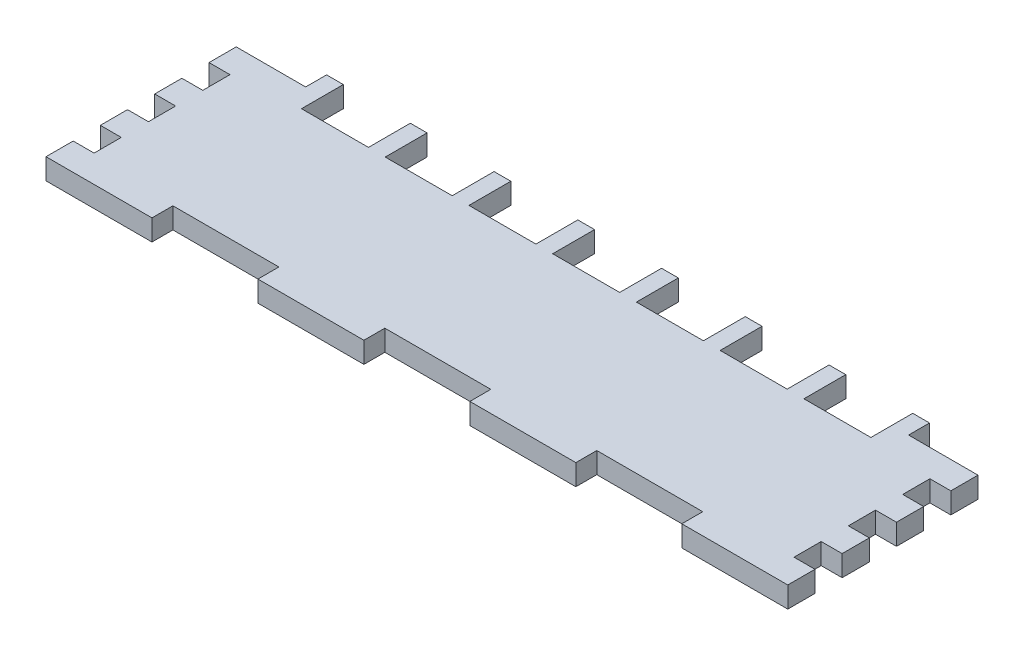
from build123d import *

# Parameters (mm, degrees)
SKETCH1_W           = 25.792857143
SKETCH1_H           = 6.35
SKETCH1_W_2         = 32.142857143
SKETCH1_W_3         = 6.35
SKETCH1_H_2         = 1.892857143
SKETCH1_H_3         = 8.242857143
BOSS_EXTRUDE1_DEPTH = 6.35
SKETCH2_W           = 225
SKETCH2_H           = 8.242857143
BOSS_EXTRUDE2_DEPTH = 6.35
SKETCH3_W           = 5.08
SKETCH3_H           = 6.35
BOSS_EXTRUDE3_DEPTH = 6.35
SKETCH4_W           = 20.32
SKETCH4_H           = 6.35
CUT_EXTRUDE1_DEPTH  = 6.35


with BuildPart() as part:
    # Sketch1 → Boss-Extrude1 (new body)
    with BuildSketch(Plane(origin=(0, 0, 0), x_dir=(1, 0, 0), z_dir=(0, 1, 0))):
        Polygon((6.35, 6.35), (32.142857143, 6.35), (64.285714286, 6.35), (96.428571429, 6.35), (128.571428571, 6.35), (160.714285714, 6.35), (192.857142857, 6.35), (218.65, 6.35), (218.65, 8.242857143), (218.65, 16.485714286), (218.65, 24.728571429), (218.65, 32.971428571), (218.65, 41.214285714), (218.65, 49.457142857), (218.65, 51.35), (192.857142857, 51.35), (160.714285714, 51.35), (128.571428571, 51.35), (96.428571429, 51.35), (64.285714286, 51.35), (32.142857143, 51.35), (6.35, 51.35), (6.35, 49.457142857), (6.35, 41.214285714), (6.35, 32.971428571), (6.35, 24.728571429), (6.35, 16.485714286), (6.35, 8.242857143), align=None)
        with Locations((19.246428572, 54.525)):
            Rectangle(SKETCH1_W, SKETCH1_H)
        with Locations((80.357142858, 54.525)):
            Rectangle(SKETCH1_W_2, SKETCH1_H)
        with Locations((144.642857143, 54.525)):
            Rectangle(SKETCH1_W_2, SKETCH1_H)
        with Locations((205.753571429, 54.525)):
            Rectangle(SKETCH1_W, SKETCH1_H)
        with Locations((221.825, 54.525)):
            Rectangle(SKETCH1_W_3, SKETCH1_H)
        with Locations((3.175, 54.525)):
            Rectangle(SKETCH1_W_3, SKETCH1_H)
        with Locations((3.175, 50.403571429)):
            Rectangle(SKETCH1_W_3, SKETCH1_H_2)
        with Locations((3.175, 7.296428571)):
            Rectangle(SKETCH1_W_3, SKETCH1_H_2)
        with Locations((3.175, 3.175)):
            Rectangle(SKETCH1_W_3, SKETCH1_H)
        with Locations((19.246428572, 3.175)):
            Rectangle(SKETCH1_W, SKETCH1_H)
        with Locations((80.357142858, 3.175)):
            Rectangle(SKETCH1_W_2, SKETCH1_H)
        with Locations((144.642857143, 3.175)):
            Rectangle(SKETCH1_W_2, SKETCH1_H)
        with Locations((205.753571429, 3.175)):
            Rectangle(SKETCH1_W, SKETCH1_H)
        with Locations((221.825, 3.175)):
            Rectangle(SKETCH1_W_3, SKETCH1_H)
        with Locations((221.825, 7.296428571)):
            Rectangle(SKETCH1_W_3, SKETCH1_H_2)
        with Locations((221.825, 50.403571429)):
            Rectangle(SKETCH1_W_3, SKETCH1_H_2)
        with Locations((221.825, 37.092857143)):
            Rectangle(SKETCH1_W_3, SKETCH1_H_3)
        with Locations((221.825, 20.607142858)):
            Rectangle(SKETCH1_W_3, SKETCH1_H_3)
        with Locations((3.175, 20.607142858)):
            Rectangle(SKETCH1_W_3, SKETCH1_H_3)
        with Locations((3.175, 37.092857143)):
            Rectangle(SKETCH1_W_3, SKETCH1_H_3)
    extrude(amount=BOSS_EXTRUDE1_DEPTH)

    # Sketch2 → Boss-Extrude2 (add)
    with BuildSketch(Plane(origin=(0, 6.35, 0), x_dir=(1, 0, 0), z_dir=(0, 1, 0))):
        with Locations((112.5, 53.578571428)):
            Rectangle(SKETCH2_W, SKETCH2_H)
    extrude(amount=-BOSS_EXTRUDE2_DEPTH)

    # Sketch3 → Boss-Extrude3 (add)
    with BuildSketch(Plane(origin=(0, 6.35, 0), x_dir=(1, 0, 0), z_dir=(0, 1, 0))):
        with Locations((23.6, 60.875)):
            Rectangle(SKETCH3_W, SKETCH3_H)
        with Locations((49, 60.875)):
            Rectangle(SKETCH3_W, SKETCH3_H)
        with Locations((74.4, 60.875)):
            Rectangle(SKETCH3_W, SKETCH3_H)
        with Locations((99.8, 60.875)):
            Rectangle(SKETCH3_W, SKETCH3_H)
        with Locations((125.2, 60.875)):
            Rectangle(SKETCH3_W, SKETCH3_H)
        with Locations((150.6, 60.875)):
            Rectangle(SKETCH3_W, SKETCH3_H)
        with Locations((176, 60.875)):
            Rectangle(SKETCH3_W, SKETCH3_H)
        with Locations((201.4, 60.875)):
            Rectangle(SKETCH3_W, SKETCH3_H)
    extrude(amount=-BOSS_EXTRUDE3_DEPTH)

    # Sketch4 → Cut-Extrude1 (cut)
    with BuildSketch(Plane(origin=(0, 6.35, 0), x_dir=(1, 0, 0), z_dir=(0, 1, 0))):
        with Locations((61.7, 54.525)):
            Rectangle(SKETCH4_W, SKETCH4_H)
        with Locations((36.3, 54.525)):
            Rectangle(SKETCH4_W, SKETCH4_H)
        with Locations((87.1, 54.525)):
            Rectangle(SKETCH4_W, SKETCH4_H)
        with Locations((112.5, 54.525)):
            Rectangle(SKETCH4_W, SKETCH4_H)
        with Locations((137.9, 54.525)):
            Rectangle(SKETCH4_W, SKETCH4_H)
        with Locations((163.3, 54.525)):
            Rectangle(SKETCH4_W, SKETCH4_H)
        with Locations((188.7, 54.525)):
            Rectangle(SKETCH4_W, SKETCH4_H)
    extrude(amount=-CUT_EXTRUDE1_DEPTH, mode=Mode.SUBTRACT)


solid = part.part
